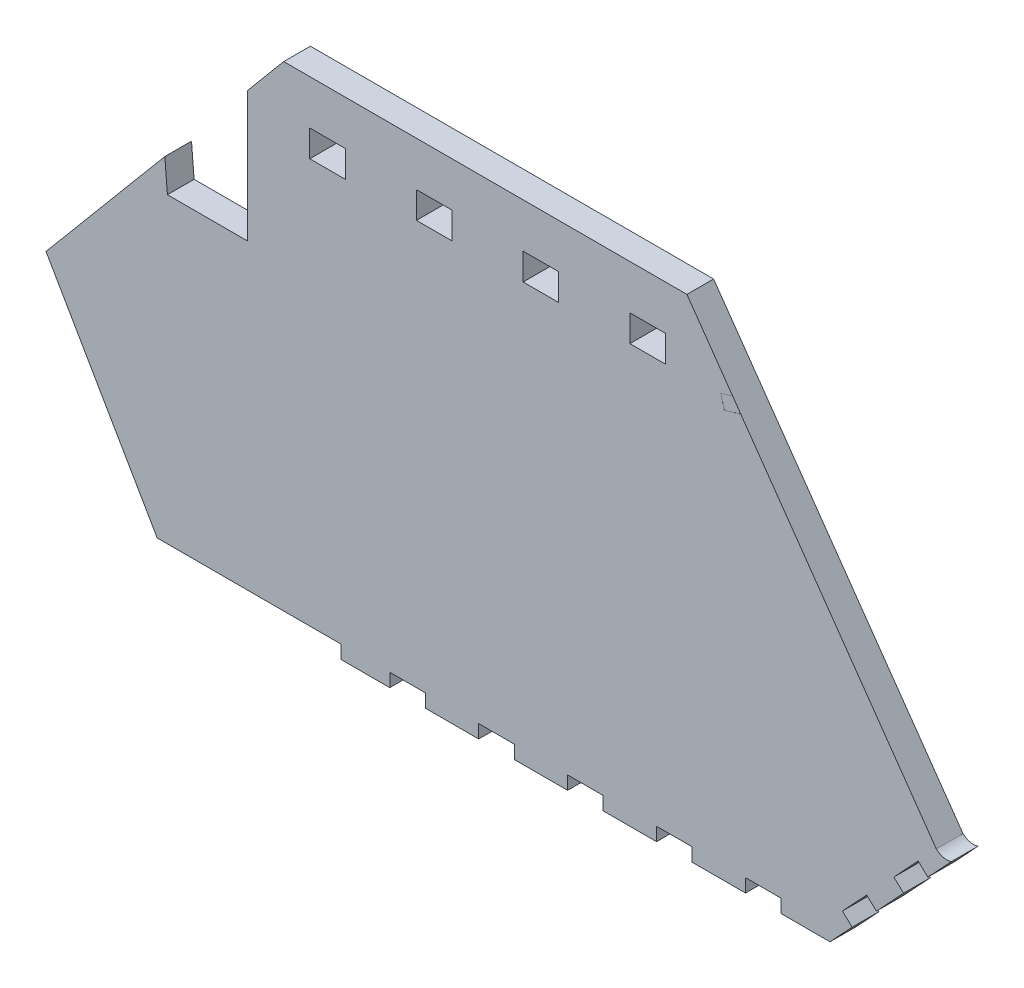
from build123d import *

# Parameters (mm, degrees)
BOSS_EXTRU_1_DEPTH      = 6
ESQUISSE3_W             = 8
ESQUISSE3_H             = 3
ENL_V_MAT_EXTRU_1_DEPTH = 6
BOSS_EXTRU_2_DEPTH      = 6
ENL_V_MAT_EXTRU_2_DEPTH = 6
ENL_V_MAT_EXTRU_3_DEPTH = 10
ESQUISSE9_W             = 8
ESQUISSE9_H             = 6
ENL_V_MAT_EXTRU_4_DEPTH = 6
ENL_V_MAT_EXTRU_5_DEPTH = 10
ENL_V_MAT_EXTRU_6_DEPTH = 0.006


with BuildPart() as part:
    # Esquisse1 → Boss.-Extru.1 (new body)
    with BuildSketch(Plane.XY):
        Polygon((0, 0), (110, 0), (137.279934402, 29.254148065), (105.119046883, 134.447671221), (102.250132615, 133.570556107), (133.904617487, 30.033401375), (108.695562875, 3), (0, 3), align=None)
    extrude(amount=BOSS_EXTRU_1_DEPTH)

    # Esquisse3 → Enlèv. mat.-Extru.1 (cut)
    with BuildSketch(Plane(origin=(0, 0, 0), x_dir=(-1, 0, 0), z_dir=(0, 0, -1))):
        with Locations((-15, 1.5)):
            Rectangle(ESQUISSE3_W, ESQUISSE3_H)
        with Locations((-35, 1.5)):
            Rectangle(ESQUISSE3_W, ESQUISSE3_H)
        with Locations((-55, 1.5)):
            Rectangle(ESQUISSE3_W, ESQUISSE3_H)
        with Locations((-75, 1.5)):
            Rectangle(ESQUISSE3_W, ESQUISSE3_H)
        with Locations((-95, 1.5)):
            Rectangle(ESQUISSE3_W, ESQUISSE3_H)
        Polygon((-112.787553035, 7.38812221), (-114.98161414, 5.34212713), (-120.437601021, 11.192956742), (-118.243539916, 13.238951823), align=None)
        Polygon((-124.356640446, 19.794449553), (-126.550701551, 17.748454473), (-132.006688432, 23.599284086), (-129.812627327, 25.645279166), align=None)
        Polygon((-107.805195005, 115.400765743), (-110.674109273, 116.277880857), (-108.335135635, 123.928318905), (-105.466221367, 123.051203791), align=None)
        Polygon((-112.981575907, 96.082249217), (-115.850490175, 96.959364332), (-113.511516537, 104.609802379), (-110.642602269, 103.732687265), align=None)
        Polygon((-118.157956809, 76.763732692), (-121.026871077, 77.640847806), (-118.687897439, 85.291285854), (-115.818983171, 84.414170739), align=None)
        Polygon((-123.334337711, 57.445216166), (-126.203251979, 58.32233128), (-123.864278341, 65.972769328), (-120.995364073, 65.095654214), align=None)
        Polygon((-128.510718613, 38.12669964), (-131.379632881, 39.003814754), (-129.040659243, 46.654252802), (-126.171744975, 45.777137688), align=None)
    extrude(amount=-ENL_V_MAT_EXTRU_1_DEPTH, mode=Mode.SUBTRACT)


with BuildPart() as enl_v_mat_extru_1_piece_1:
    # of the separate pieces the step leaves, piece 1, a body of its own (enl_v_mat_extru_1_pieces)
    add(part.part.solids().sort_by_distance((132.006688432, 23.599284086, 0))[0])



with BuildPart() as enl_v_mat_extru_1_piece_2:
    # of the separate pieces the step leaves, piece 2, a body of its own (enl_v_mat_extru_1_pieces)
    add(part.part.solids().sort_by_distance((99, 0, 0))[0])


with BuildPart() as enl_v_mat_extru_1_piece_3:
    # of the separate pieces the step leaves, piece 3, a body of its own (enl_v_mat_extru_1_pieces)
    add(part.part.solids().sort_by_distance((39, 0, 0))[0])


with BuildPart() as enl_v_mat_extru_1_piece_4:
    # of the separate pieces the step leaves, piece 4, a body of its own (enl_v_mat_extru_1_pieces)
    add(part.part.solids().sort_by_distance((19, 0, 0))[0])


with BuildPart() as enl_v_mat_extru_1_piece_5:
    # of the separate pieces the step leaves, piece 5, a body of its own (enl_v_mat_extru_1_pieces)
    add(part.part.solids().sort_by_distance((59, 0, 0))[0])


with BuildPart() as enl_v_mat_extru_1_piece_6:
    # of the separate pieces the step leaves, piece 6, a body of its own (enl_v_mat_extru_1_pieces)
    add(part.part.solids().sort_by_distance((79, 0, 0))[0])


with BuildPart() as enl_v_mat_extru_1_piece_7:
    # of the separate pieces the step leaves, piece 7, a body of its own (enl_v_mat_extru_1_pieces)
    add(part.part.solids().sort_by_distance((0, 0, 0))[0])


with BuildPart() as enl_v_mat_extru_1_piece_8:
    # of the separate pieces the step leaves, piece 8, a body of its own (enl_v_mat_extru_1_pieces)
    add(part.part.solids().sort_by_distance((108.335135635, 123.928318905, 0))[0])


with BuildPart() as enl_v_mat_extru_1_piece_9:
    # of the separate pieces the step leaves, piece 9, a body of its own (enl_v_mat_extru_1_pieces)
    add(part.part.solids().sort_by_distance((120.437601021, 11.192956742, 0))[0])


with BuildPart() as enl_v_mat_extru_1_piece_1_1:
    add(enl_v_mat_extru_1_piece_1.part)

    add(enl_v_mat_extru_1_piece_2.part)  # Boss.-Extru.2 merges Enlèv. mat.-Extru.1 piece 2

    add(enl_v_mat_extru_1_piece_3.part)  # Boss.-Extru.2 merges Enlèv. mat.-Extru.1 piece 3

    add(enl_v_mat_extru_1_piece_4.part)  # Boss.-Extru.2 merges Enlèv. mat.-Extru.1 piece 4

    add(enl_v_mat_extru_1_piece_5.part)  # Boss.-Extru.2 merges Enlèv. mat.-Extru.1 piece 5

    add(enl_v_mat_extru_1_piece_6.part)  # Boss.-Extru.2 merges Enlèv. mat.-Extru.1 piece 6

    add(enl_v_mat_extru_1_piece_7.part)  # Boss.-Extru.2 merges Enlèv. mat.-Extru.1 piece 7

    add(enl_v_mat_extru_1_piece_9.part)  # Boss.-Extru.2 merges Enlèv. mat.-Extru.1 piece 9
    # Esquisse4 → Boss.-Extru.2 (add)
    with BuildSketch(Plane(origin=(0, 0, 0), x_dir=(-1, 0, 0), z_dir=(0, 0, -1))):
        Polygon((-39, 3), (0, 3), (41.304437125, 3), (66.304437125, 46.301270189), (-36.541580425, 168.868381088), (-133.904617487, 30.033401375), (-108.695562875, 3), (-51, 3), align=None)
    extrude(amount=-BOSS_EXTRU_2_DEPTH)


with BuildPart() as enl_v_mat_extru_2_tool:
    # Esquisse7 → Enlèv. mat.-Extru.2 (new body)
    with BuildSketch(Plane(origin=(0, 0, 0), x_dir=(-1, 0, 0), z_dir=(0, 0, -1))):
        with BuildLine():
            Line((-137.279934402, 29.254148065), (-105.119046883, 134.447671221))
            Line((-105.119046883, 134.447671221), (-102.250132615, 133.570556107))
            Line((-102.250132615, 133.570556107), (-133.904617487, 30.033401375))
            ThreePointArc((-133.904617487, 30.033401375), (-135.487875797, 29.191567999), (-137.279934402, 29.254148065))
        make_face()
    extrude(amount=-ENL_V_MAT_EXTRU_2_DEPTH)


with BuildPart() as enl_v_mat_extru_1_piece_1_2:
    add(enl_v_mat_extru_1_piece_1_1.part)

    # Enlèv. mat.-Extru.2: cut by enl_v_mat_extru_2_tool
    add(enl_v_mat_extru_2_tool.part, mode=Mode.SUBTRACT)

    # Esquisse8 → Enlèv. mat.-Extru.3 (cut)
    with BuildSketch(Plane(origin=(0, 0, 0), x_dir=(-1, 0, 0), z_dir=(0, 0, -1))):
        Polygon((12.854856434, 110), (-77.825155944, 110), (-36.541580425, 168.868381088), align=None)
    extrude(amount=-ENL_V_MAT_EXTRU_3_DEPTH, mode=Mode.SUBTRACT)

    # Esquisse9 → Enlèv. mat.-Extru.4 (cut)
    with BuildSketch(Plane.XY.offset(6)):
        with Locations((69, 97)):
            Rectangle(ESQUISSE9_W, ESQUISSE9_H)
        with Locations((45, 97)):
            Rectangle(ESQUISSE9_W, ESQUISSE9_H)
        with Locations((21, 97)):
            Rectangle(ESQUISSE9_W, ESQUISSE9_H)
        with Locations((-3, 97)):
            Rectangle(ESQUISSE9_W, ESQUISSE9_H)
    extrude(amount=-ENL_V_MAT_EXTRU_4_DEPTH, mode=Mode.SUBTRACT)

    # Esquisse10 → Enlèv. mat.-Extru.5 (cut)
    with BuildSketch(Plane.XY.offset(6)):
        Polygon((-21, 71), (-21, 100.292995893), (-39.57964678, 78.150635095), (-39, 71), align=None)
    extrude(amount=-ENL_V_MAT_EXTRU_5_DEPTH, mode=Mode.SUBTRACT)

    # Esquisse11 → Enlèv. mat.-Extru.6 (cut)
    with BuildSketch(Plane.XY.offset(6)):
        Polygon((86.271198829, 91.64198356), (89.917576683, 92.756793146), (88.105999998, 95.340013841), (85.394083714, 94.510897828), align=None)
    extrude(amount=-ENL_V_MAT_EXTRU_6_DEPTH, mode=Mode.SUBTRACT)


with BuildPart() as enl_v_mat_extru_1_piece_8_1:
    add(enl_v_mat_extru_1_piece_8.part)

    # Enlèv. mat.-Extru.2: cut by enl_v_mat_extru_2_tool
    add(enl_v_mat_extru_2_tool.part, mode=Mode.SUBTRACT)


solid = enl_v_mat_extru_1_piece_1_2.part
